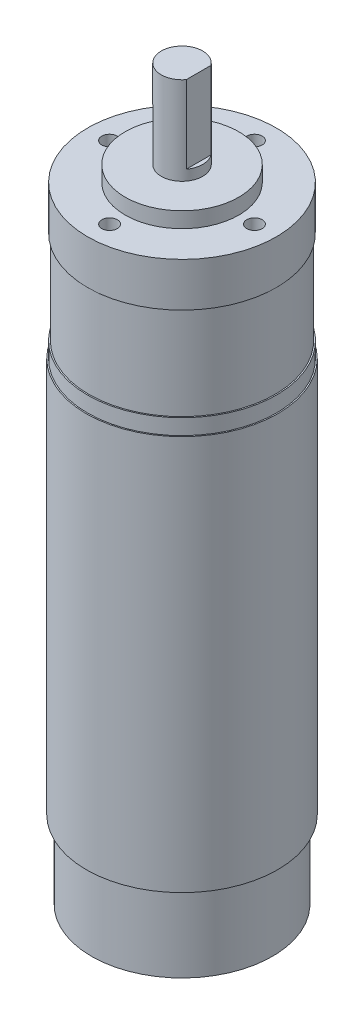
from build123d import *

# Parameters (mm, degrees)
ESQUISSE1_R      = 17.492
EXTRUSION1_DEPTH = 15
ESQUISSE2_R      = 18.491
EXTRUSION2_DEPTH = 76.339
ESQUISSE3_R      = 18.25
EXTRUSION3_DEPTH = 3
ESQUISSE4_R      = 18
EXTRUSION4_DEPTH = 18
ESQUISSE5_R      = 18.241
EXTRUSION5_DEPTH = 8.5
ESQUISSE6_R      = 10.977
EXTRUSION6_DEPTH = 3
ESQUISSE7_R      = 4
EXTRUSION7_DEPTH = 17
ESQUISSE8_W      = 2.691612919
ESQUISSE8_H      = 12.532822653
EXTRUSION8_DEPTH = 15
ESQUISSE9_R      = 1.5
EXTRUSION9_DEPTH = 7


with BuildPart() as part:
    # Esquisse1 → Extrusion1 (new body)
    with BuildSketch(Plane(origin=(0, 0, 0), x_dir=(1, 0, 0), z_dir=(0, 1, 0))):
        with Locations(Location((0, 0, 0), (0, 0, 270))):
            Circle(ESQUISSE1_R)
    extrude(amount=EXTRUSION1_DEPTH)

    # Esquisse2 → Extrusion2 (add)
    with BuildSketch(Plane(origin=(0, 15, 0), x_dir=(1, 0, 0), z_dir=(0, 1, 0))):
        with Locations(Location((0, 0, 0), (0, 0, 270))):
            Circle(ESQUISSE2_R)
    extrude(amount=EXTRUSION2_DEPTH)

    # Esquisse3 → Extrusion3 (add)
    with BuildSketch(Plane(origin=(0, 91.339, 0), x_dir=(1, 0, 0), z_dir=(0, 1, 0))):
        with Locations(Location((0, 0, 0), (0, 0, 270))):
            Circle(ESQUISSE3_R)
    extrude(amount=EXTRUSION3_DEPTH)

    # Esquisse4 → Extrusion4 (add)
    with BuildSketch(Plane(origin=(0, 94.339, 0), x_dir=(1, 0, 0), z_dir=(0, 1, 0))):
        with Locations(Location((0, 0, 0), (0, 0, 270))):
            Circle(ESQUISSE4_R)
    extrude(amount=EXTRUSION4_DEPTH)

    # Esquisse5 → Extrusion5 (add)
    with BuildSketch(Plane(origin=(0, 112.339, 0), x_dir=(1, 0, 0), z_dir=(0, 1, 0))):
        with Locations(Location((0, 0, 0), (0, 0, 270))):
            Circle(ESQUISSE5_R)
    extrude(amount=EXTRUSION5_DEPTH)

    # Esquisse6 → Extrusion6 (add)
    with BuildSketch(Plane(origin=(0, 120.839, 0), x_dir=(1, 0, 0), z_dir=(0, 1, 0))):
        with Locations(Location((0, 0, 0), (0, 0, 270))):
            Circle(ESQUISSE6_R)
    extrude(amount=EXTRUSION6_DEPTH)

    # Esquisse7 → Extrusion7 (add)
    with BuildSketch(Plane(origin=(0, 123.839, 0), x_dir=(-1, 0, 0), z_dir=(0, 1, 0))):
        with Locations(Location((0, 0, 0), (0, 0, 90))):
            Circle(ESQUISSE7_R)
    extrude(amount=EXTRUSION7_DEPTH)

    # Esquisse8 → Extrusion8 (cut)
    with BuildSketch(Plane(origin=(0, 140.839, 0), x_dir=(1, 0, 0), z_dir=(0, 1, 0))):
        with Locations((4.55780646, -1.030383071)):
            Rectangle(ESQUISSE8_W, ESQUISSE8_H)
    extrude(amount=-EXTRUSION8_DEPTH, mode=Mode.SUBTRACT)

    # Esquisse9 → Extrusion9 (cut)
    with BuildSketch(Plane(origin=(0, 120.839, 0), x_dir=(1, 0, 0), z_dir=(0, 1, 0))):
        with Locations(Location((0, 14, 0), (0, 0, 270))):
            Circle(ESQUISSE9_R)
        with Locations(Location((14.001, 0.001, 0), (0, 0, 270))):
            Circle(ESQUISSE9_R)
        with Locations(Location((0.002, -14, 0), (0, 0, 270))):
            Circle(ESQUISSE9_R)
        with Locations(Location((-13.999, -0.001, 0), (0, 0, 270))):
            Circle(ESQUISSE9_R)
    extrude(amount=-EXTRUSION9_DEPTH, mode=Mode.SUBTRACT)


solid = part.part
